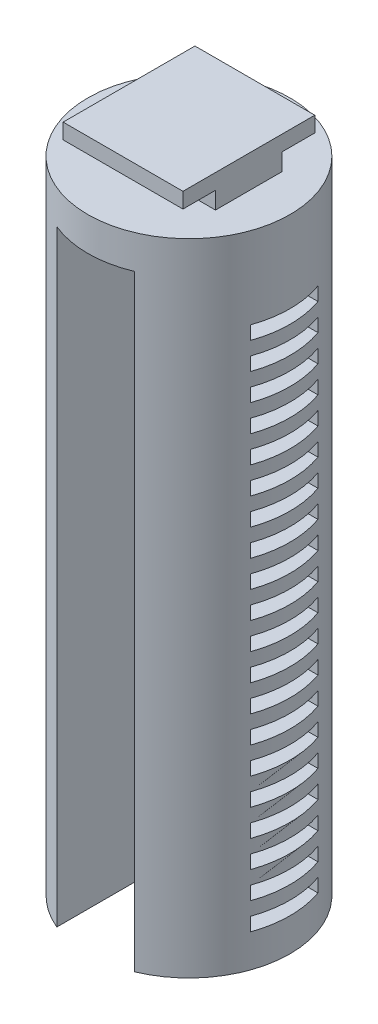
from build123d import *

# Parameters (mm, degrees)
BOSS_EXTRUDE1_DEPTH        = 90
BOSS_EXTRUDE1_2_DEPTH      = 90
SKETCH2_R                  = 15
BOSS_EXTRUDE2_DEPTH        = 5
SKETCH4_W                  = 17.78
SKETCH4_H                  = 9.906
BOSS_EXTRUDE3_DEPTH        = 4.826
SKETCH9_W                  = 17.78
SKETCH9_H                  = 2.286
BOSS_EXTRUDE9_DEPTH        = 4.826
SKETCH3_W                  = 10
SKETCH3_H                  = 2
CUT_EXTRUDE1_DEPTH         = 7
LPATTERN1_COUNT            = 20
LPATTERN1_PITCH            = 4
LPATTERN1_COPY_1_SKETCH_W  = 10
LPATTERN1_COPY_1_SKETCH_H  = 2
LPATTERN1_COPY_1_DEPTH     = 7
LPATTERN1_COPY_2_SKETCH_W  = 10
LPATTERN1_COPY_2_SKETCH_H  = 2
LPATTERN1_COPY_2_DEPTH     = 7
LPATTERN1_COPY_3_SKETCH_W  = 10
LPATTERN1_COPY_3_SKETCH_H  = 2
LPATTERN1_COPY_3_DEPTH     = 7
LPATTERN1_COPY_4_SKETCH_W  = 10
LPATTERN1_COPY_4_SKETCH_H  = 2
LPATTERN1_COPY_4_DEPTH     = 7
LPATTERN1_COPY_5_SKETCH_W  = 10
LPATTERN1_COPY_5_SKETCH_H  = 2
LPATTERN1_COPY_5_DEPTH     = 7
LPATTERN1_COPY_6_SKETCH_W  = 10
LPATTERN1_COPY_6_SKETCH_H  = 2
LPATTERN1_COPY_6_DEPTH     = 7
LPATTERN1_COPY_7_SKETCH_W  = 10
LPATTERN1_COPY_7_SKETCH_H  = 2
LPATTERN1_COPY_7_DEPTH     = 7
LPATTERN1_COPY_8_SKETCH_W  = 10
LPATTERN1_COPY_8_SKETCH_H  = 2
LPATTERN1_COPY_8_DEPTH     = 7
LPATTERN1_COPY_9_SKETCH_W  = 10
LPATTERN1_COPY_9_SKETCH_H  = 2
LPATTERN1_COPY_9_DEPTH     = 7
LPATTERN1_COPY_10_SKETCH_W = 10
LPATTERN1_COPY_10_SKETCH_H = 2
LPATTERN1_COPY_10_DEPTH    = 7
LPATTERN1_COPY_11_SKETCH_W = 10
LPATTERN1_COPY_11_SKETCH_H = 2
LPATTERN1_COPY_11_DEPTH    = 7
LPATTERN1_COPY_12_SKETCH_W = 10
LPATTERN1_COPY_12_SKETCH_H = 2
LPATTERN1_COPY_12_DEPTH    = 7
LPATTERN1_COPY_13_SKETCH_W = 10
LPATTERN1_COPY_13_SKETCH_H = 2
LPATTERN1_COPY_13_DEPTH    = 7
LPATTERN1_COPY_14_SKETCH_W = 10
LPATTERN1_COPY_14_SKETCH_H = 2
LPATTERN1_COPY_14_DEPTH    = 7
LPATTERN1_COPY_15_SKETCH_W = 10
LPATTERN1_COPY_15_SKETCH_H = 2
LPATTERN1_COPY_15_DEPTH    = 7
LPATTERN1_COPY_16_SKETCH_W = 10
LPATTERN1_COPY_16_SKETCH_H = 2
LPATTERN1_COPY_16_DEPTH    = 7
LPATTERN1_COPY_17_SKETCH_W = 10
LPATTERN1_COPY_17_SKETCH_H = 2
LPATTERN1_COPY_17_DEPTH    = 7
LPATTERN1_COPY_18_SKETCH_W = 10
LPATTERN1_COPY_18_SKETCH_H = 2
LPATTERN1_COPY_18_DEPTH    = 7
LPATTERN1_COPY_19_SKETCH_W = 10
LPATTERN1_COPY_19_SKETCH_H = 2
LPATTERN1_COPY_19_DEPTH    = 7


with BuildPart() as part:
    # Sketch1 → Boss-Extrude1 (new body)
    with BuildSketch(Plane(origin=(0, 0, 0), x_dir=(1, 0, 0), z_dir=(0, 1, 0))):
        with BuildLine():
            Line((-5.75, 13.854151002), (-5.75, -13.854151002))
            ThreePointArc((-5.75, -13.854151002), (-15, 0), (-5.75, 13.854151002))
        make_face()
    extrude(amount=BOSS_EXTRUDE1_DEPTH)



with BuildPart() as body_2:
    # Sketch1 → Boss-Extrude1 2 (new body)
    with BuildSketch(Plane(origin=(0, 0, 0), x_dir=(1, 0, 0), z_dir=(0, 1, 0))):
        with BuildLine():
            Line((5.75, 13.854151002), (5.75, -13.854151002))
            ThreePointArc((5.75, -13.854151002), (15, 0), (5.75, 13.854151002))
        make_face()
    extrude(amount=BOSS_EXTRUDE1_2_DEPTH)


with BuildPart() as part_1:
    add(part.part)

    add(body_2.part)  # Boss-Extrude2 merges body 2
    # Sketch2 → Boss-Extrude2 (add)
    with BuildSketch(Plane(origin=(0, 90, 0), x_dir=(1, 0, 0), z_dir=(0, 1, 0))):
        with Locations(Location((0, 0, 0), (0, 0, 112.540310464))):
            Circle(SKETCH2_R)
    extrude(amount=BOSS_EXTRUDE2_DEPTH)

    # Sketch4 → Boss-Extrude3 (add)
    with BuildSketch(Plane(origin=(0, 95, 0), x_dir=(1, 0, 0), z_dir=(0, 1, 0))):
        Rectangle(SKETCH4_W, SKETCH4_H)
    extrude(amount=BOSS_EXTRUDE3_DEPTH)

    # Sketch9 → Boss-Extrude9 (add)
    with BuildSketch(Plane(origin=(0, 0, -4.953), x_dir=(-1, 0, 0), z_dir=(0, 0, -1))):
        with Locations((0, 98.683)):
            Rectangle(SKETCH9_W, SKETCH9_H)
    boss_extrude9 = extrude(amount=BOSS_EXTRUDE9_DEPTH)

    # Sketch3 → Cut-Extrude1 (cut)
    with BuildSketch(Plane.ZY.offset(15)):
        with Locations((0, 5.9)):
            Rectangle(SKETCH3_W, SKETCH3_H)
    cut_extrude1 = extrude(amount=-CUT_EXTRUDE1_DEPTH, mode=Mode.SUBTRACT)

    # Mirror2: Cut-Extrude1 across plane
    add(cut_extrude1.mirror(Plane.ZY), mode=Mode.SUBTRACT)

    # Mirror5: Boss-Extrude9 across plane
    add(boss_extrude9.mirror(Plane(origin=(0, 0, 0), x_dir=(1, 0, 0), z_dir=(0, 0, -1))))

    # LPattern1: Cut-Extrude1 ×20
    with Locations(*[(0, i * LPATTERN1_PITCH, 0) for i in range(1, LPATTERN1_COUNT)]):
        add(cut_extrude1, mode=Mode.SUBTRACT)

    # LPattern1 copy 1 sketch → LPattern1 copy 1 (cut)
    with BuildSketch(Plane(origin=(15, 4, 0), x_dir=(0, 0, 1), z_dir=(1, 0, 0))):
        with Locations((0, -5.9)):
            Rectangle(LPATTERN1_COPY_1_SKETCH_W, LPATTERN1_COPY_1_SKETCH_H)
    extrude(amount=-LPATTERN1_COPY_1_DEPTH, mode=Mode.SUBTRACT)

    # LPattern1 copy 2 sketch → LPattern1 copy 2 (cut)
    with BuildSketch(Plane(origin=(15, 8, 0), x_dir=(0, 0, 1), z_dir=(1, 0, 0))):
        with Locations((0, -5.9)):
            Rectangle(LPATTERN1_COPY_2_SKETCH_W, LPATTERN1_COPY_2_SKETCH_H)
    extrude(amount=-LPATTERN1_COPY_2_DEPTH, mode=Mode.SUBTRACT)

    # LPattern1 copy 3 sketch → LPattern1 copy 3 (cut)
    with BuildSketch(Plane(origin=(15, 12, 0), x_dir=(0, 0, 1), z_dir=(1, 0, 0))):
        with Locations((0, -5.9)):
            Rectangle(LPATTERN1_COPY_3_SKETCH_W, LPATTERN1_COPY_3_SKETCH_H)
    extrude(amount=-LPATTERN1_COPY_3_DEPTH, mode=Mode.SUBTRACT)

    # LPattern1 copy 4 sketch → LPattern1 copy 4 (cut)
    with BuildSketch(Plane(origin=(15, 16, 0), x_dir=(0, 0, 1), z_dir=(1, 0, 0))):
        with Locations((0, -5.9)):
            Rectangle(LPATTERN1_COPY_4_SKETCH_W, LPATTERN1_COPY_4_SKETCH_H)
    extrude(amount=-LPATTERN1_COPY_4_DEPTH, mode=Mode.SUBTRACT)

    # LPattern1 copy 5 sketch → LPattern1 copy 5 (cut)
    with BuildSketch(Plane(origin=(15, 20, 0), x_dir=(0, 0, 1), z_dir=(1, 0, 0))):
        with Locations((0, -5.9)):
            Rectangle(LPATTERN1_COPY_5_SKETCH_W, LPATTERN1_COPY_5_SKETCH_H)
    extrude(amount=-LPATTERN1_COPY_5_DEPTH, mode=Mode.SUBTRACT)

    # LPattern1 copy 6 sketch → LPattern1 copy 6 (cut)
    with BuildSketch(Plane(origin=(15, 24, 0), x_dir=(0, 0, 1), z_dir=(1, 0, 0))):
        with Locations((0, -5.9)):
            Rectangle(LPATTERN1_COPY_6_SKETCH_W, LPATTERN1_COPY_6_SKETCH_H)
    extrude(amount=-LPATTERN1_COPY_6_DEPTH, mode=Mode.SUBTRACT)

    # LPattern1 copy 7 sketch → LPattern1 copy 7 (cut)
    with BuildSketch(Plane(origin=(15, 28, 0), x_dir=(0, 0, 1), z_dir=(1, 0, 0))):
        with Locations((0, -5.9)):
            Rectangle(LPATTERN1_COPY_7_SKETCH_W, LPATTERN1_COPY_7_SKETCH_H)
    extrude(amount=-LPATTERN1_COPY_7_DEPTH, mode=Mode.SUBTRACT)

    # LPattern1 copy 8 sketch → LPattern1 copy 8 (cut)
    with BuildSketch(Plane(origin=(15, 32, 0), x_dir=(0, 0, 1), z_dir=(1, 0, 0))):
        with Locations((0, -5.9)):
            Rectangle(LPATTERN1_COPY_8_SKETCH_W, LPATTERN1_COPY_8_SKETCH_H)
    extrude(amount=-LPATTERN1_COPY_8_DEPTH, mode=Mode.SUBTRACT)

    # LPattern1 copy 9 sketch → LPattern1 copy 9 (cut)
    with BuildSketch(Plane(origin=(15, 36, 0), x_dir=(0, 0, 1), z_dir=(1, 0, 0))):
        with Locations((0, -5.9)):
            Rectangle(LPATTERN1_COPY_9_SKETCH_W, LPATTERN1_COPY_9_SKETCH_H)
    extrude(amount=-LPATTERN1_COPY_9_DEPTH, mode=Mode.SUBTRACT)

    # LPattern1 copy 10 sketch → LPattern1 copy 10 (cut)
    with BuildSketch(Plane(origin=(15, 40, 0), x_dir=(0, 0, 1), z_dir=(1, 0, 0))):
        with Locations((0, -5.9)):
            Rectangle(LPATTERN1_COPY_10_SKETCH_W, LPATTERN1_COPY_10_SKETCH_H)
    extrude(amount=-LPATTERN1_COPY_10_DEPTH, mode=Mode.SUBTRACT)

    # LPattern1 copy 11 sketch → LPattern1 copy 11 (cut)
    with BuildSketch(Plane(origin=(15, 44, 0), x_dir=(0, 0, 1), z_dir=(1, 0, 0))):
        with Locations((0, -5.9)):
            Rectangle(LPATTERN1_COPY_11_SKETCH_W, LPATTERN1_COPY_11_SKETCH_H)
    extrude(amount=-LPATTERN1_COPY_11_DEPTH, mode=Mode.SUBTRACT)

    # LPattern1 copy 12 sketch → LPattern1 copy 12 (cut)
    with BuildSketch(Plane(origin=(15, 48, 0), x_dir=(0, 0, 1), z_dir=(1, 0, 0))):
        with Locations((0, -5.9)):
            Rectangle(LPATTERN1_COPY_12_SKETCH_W, LPATTERN1_COPY_12_SKETCH_H)
    extrude(amount=-LPATTERN1_COPY_12_DEPTH, mode=Mode.SUBTRACT)

    # LPattern1 copy 13 sketch → LPattern1 copy 13 (cut)
    with BuildSketch(Plane(origin=(15, 52, 0), x_dir=(0, 0, 1), z_dir=(1, 0, 0))):
        with Locations((0, -5.9)):
            Rectangle(LPATTERN1_COPY_13_SKETCH_W, LPATTERN1_COPY_13_SKETCH_H)
    extrude(amount=-LPATTERN1_COPY_13_DEPTH, mode=Mode.SUBTRACT)

    # LPattern1 copy 14 sketch → LPattern1 copy 14 (cut)
    with BuildSketch(Plane(origin=(15, 56, 0), x_dir=(0, 0, 1), z_dir=(1, 0, 0))):
        with Locations((0, -5.9)):
            Rectangle(LPATTERN1_COPY_14_SKETCH_W, LPATTERN1_COPY_14_SKETCH_H)
    extrude(amount=-LPATTERN1_COPY_14_DEPTH, mode=Mode.SUBTRACT)

    # LPattern1 copy 15 sketch → LPattern1 copy 15 (cut)
    with BuildSketch(Plane(origin=(15, 60, 0), x_dir=(0, 0, 1), z_dir=(1, 0, 0))):
        with Locations((0, -5.9)):
            Rectangle(LPATTERN1_COPY_15_SKETCH_W, LPATTERN1_COPY_15_SKETCH_H)
    extrude(amount=-LPATTERN1_COPY_15_DEPTH, mode=Mode.SUBTRACT)

    # LPattern1 copy 16 sketch → LPattern1 copy 16 (cut)
    with BuildSketch(Plane(origin=(15, 64, 0), x_dir=(0, 0, 1), z_dir=(1, 0, 0))):
        with Locations((0, -5.9)):
            Rectangle(LPATTERN1_COPY_16_SKETCH_W, LPATTERN1_COPY_16_SKETCH_H)
    extrude(amount=-LPATTERN1_COPY_16_DEPTH, mode=Mode.SUBTRACT)

    # LPattern1 copy 17 sketch → LPattern1 copy 17 (cut)
    with BuildSketch(Plane(origin=(15, 68, 0), x_dir=(0, 0, 1), z_dir=(1, 0, 0))):
        with Locations((0, -5.9)):
            Rectangle(LPATTERN1_COPY_17_SKETCH_W, LPATTERN1_COPY_17_SKETCH_H)
    extrude(amount=-LPATTERN1_COPY_17_DEPTH, mode=Mode.SUBTRACT)

    # LPattern1 copy 18 sketch → LPattern1 copy 18 (cut)
    with BuildSketch(Plane(origin=(15, 72, 0), x_dir=(0, 0, 1), z_dir=(1, 0, 0))):
        with Locations((0, -5.9)):
            Rectangle(LPATTERN1_COPY_18_SKETCH_W, LPATTERN1_COPY_18_SKETCH_H)
    extrude(amount=-LPATTERN1_COPY_18_DEPTH, mode=Mode.SUBTRACT)

    # LPattern1 copy 19 sketch → LPattern1 copy 19 (cut)
    with BuildSketch(Plane(origin=(15, 76, 0), x_dir=(0, 0, 1), z_dir=(1, 0, 0))):
        with Locations((0, -5.9)):
            Rectangle(LPATTERN1_COPY_19_SKETCH_W, LPATTERN1_COPY_19_SKETCH_H)
    extrude(amount=-LPATTERN1_COPY_19_DEPTH, mode=Mode.SUBTRACT)


solid = part_1.part
